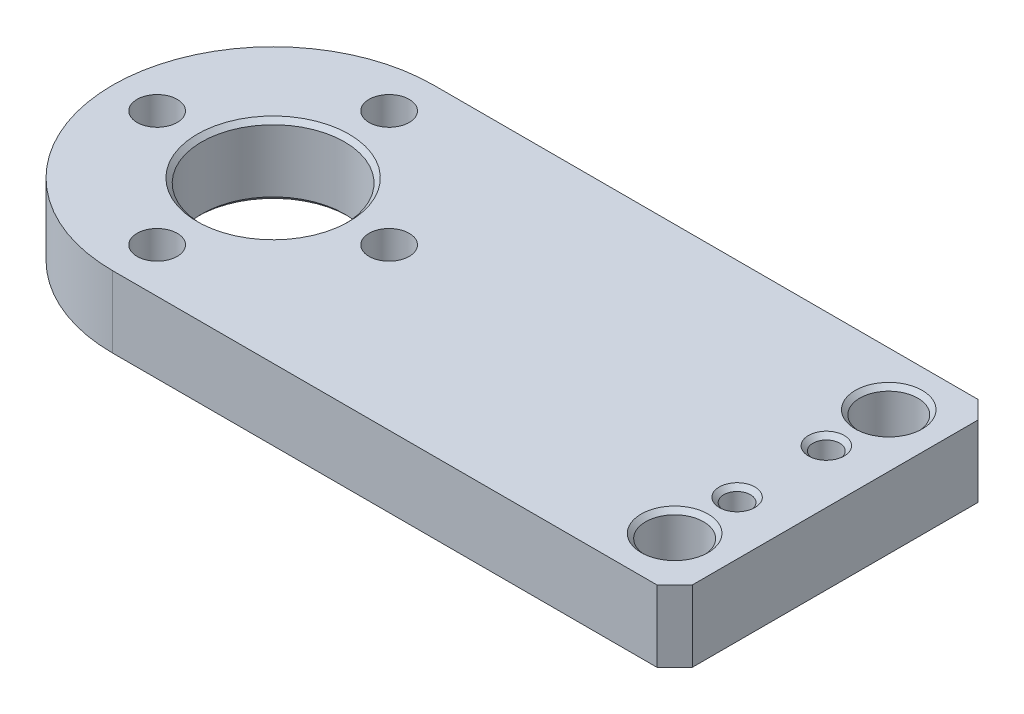
from build123d import *

# Parameters (mm, degrees)
BOSS_EXTRUDE1_DEPTH = 8
SKETCH3_R           = 8
CUT_EXTRUDE1_DEPTH  = 74
SKETCH4_R           = 3.25
CUT_EXTRUDE2_DEPTH  = 74
SKETCH5_R           = 1.5
CUT_EXTRUDE3_DEPTH  = 74
SKETCH6_R           = 2.25
CUT_EXTRUDE4_DEPTH  = 74
CHAMFER1_SIZE       = 0.5
CHAMFER2_SIZE       = 2


with BuildPart() as part:
    # Sketch1 → Boss-Extrude1 (new body)
    with BuildSketch(Plane(origin=(0, 0, 0), x_dir=(1, 0, 0), z_dir=(0, 1, 0))):
        with BuildLine():
            Line((0, 0), (63, 0))
            Line((63, 0), (63, 36))
            Line((63, 36), (0, 36))
            ThreePointArc((0, 36), (-18, 18), (0, 0))
        make_face()
    extrude(amount=BOSS_EXTRUDE1_DEPTH)

    # Sketch3 → Cut-Extrude1 (cut, through all)
    with BuildSketch(Plane(origin=(0, 8, 0), x_dir=(1, 0, 0), z_dir=(0, 1, 0))):
        with Locations(Location((0, 18, 0), (0, 0, 270))):
            Circle(SKETCH3_R)
    extrude(amount=-CUT_EXTRUDE1_DEPTH, mode=Mode.SUBTRACT)

    # Sketch4 → Cut-Extrude2 (cut, through all)
    with BuildSketch(Plane(origin=(0, 8, 0), x_dir=(1, 0, 0), z_dir=(0, 1, 0))):
        with Locations(Location((57, 30, 0), (0, 0, 270))):
            Circle(SKETCH4_R)
        with Locations(Location((57, 6, 0), (0, 0, 270))):
            Circle(SKETCH4_R)
    extrude(amount=-CUT_EXTRUDE2_DEPTH, mode=Mode.SUBTRACT)

    # Sketch5 → Cut-Extrude3 (cut, through all)
    with BuildSketch(Plane(origin=(0, 8, 0), x_dir=(1, 0, 0), z_dir=(0, 1, 0))):
        with Locations(Location((57, 23, 0), (0, 0, 270))):
            Circle(SKETCH5_R)
        with Locations(Location((57, 13, 0), (0, 0, 270))):
            Circle(SKETCH5_R)
    extrude(amount=-CUT_EXTRUDE3_DEPTH, mode=Mode.SUBTRACT)

    # Sketch6 → Cut-Extrude4 (cut, through all)
    with BuildSketch(Plane(origin=(0, 8, 0), x_dir=(1, 0, 0), z_dir=(0, 1, 0))):
        with Locations(Location((0, 31, 0), (0, 0, 270))):
            Circle(SKETCH6_R)
        with Locations(Location((13, 18, 0), (0, 0, 270))):
            Circle(SKETCH6_R)
        with Locations(Location((0, 5, 0), (0, 0, 270))):
            Circle(SKETCH6_R)
        with Locations(Location((-13, 18, 0), (0, 0, 270))):
            Circle(SKETCH6_R)
    extrude(amount=-CUT_EXTRUDE4_DEPTH, mode=Mode.SUBTRACT)

    # Chamfer1
    chamfer1_edges = [part.edges().sort_by_distance(p)[0] for p in [
        (0, 0, -26),
        (0, 8, -26),
        (57, 0, -33.25),
        (57, 8, -33.25),
        (57, 0, -9.25),
        (57, 8, -9.25),
        (57, 0, -24.5),
        (57, 8, -24.5),
        (57, 0, -14.5),
        (57, 8, -14.5),
    ]]
    chamfer(chamfer1_edges, length=CHAMFER1_SIZE)

    # Chamfer2
    chamfer2_edges = [part.edges().sort_by_distance(p)[0] for p in [
        (63, 4, -36),
        (63, 4, 0),
    ]]
    chamfer(chamfer2_edges, length=CHAMFER2_SIZE)


solid = part.part
